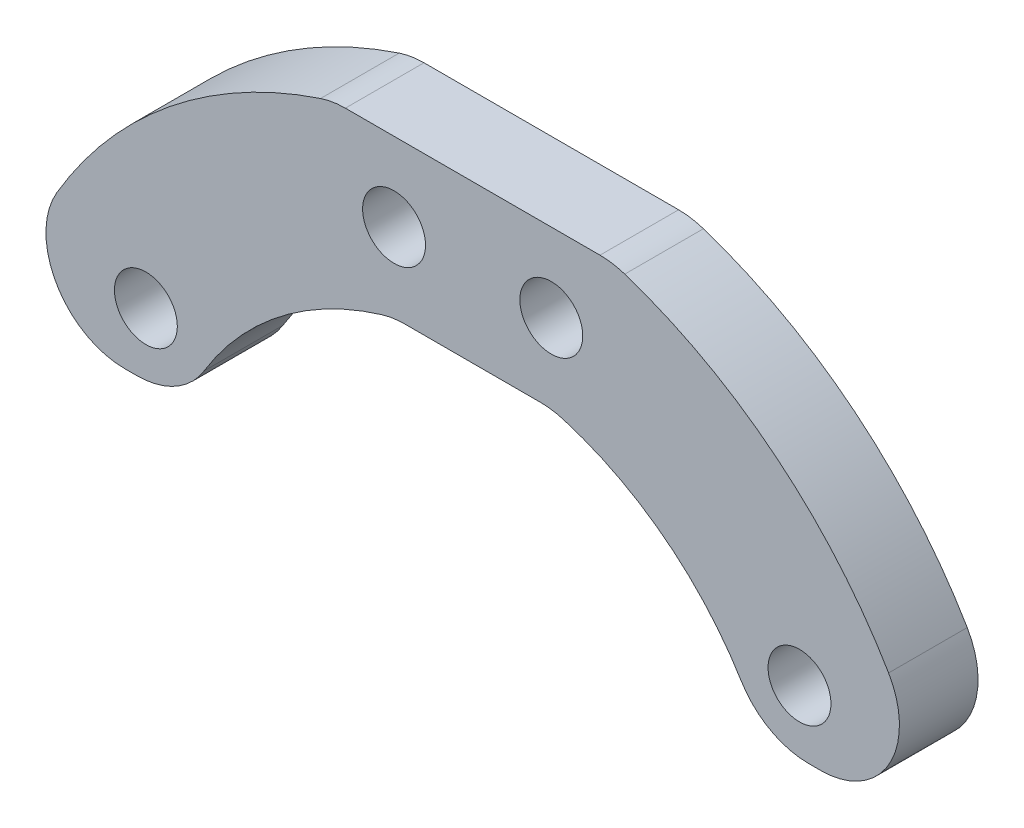
from build123d import *

# Parameters (mm, degrees)
SKETCH1_R           = 2
BOSS_EXTRUDE1_DEPTH = 5
FILLET1_R           = 5


with BuildPart() as part:
    # Sketch1 → Boss-Extrude1 (new body)
    with BuildSketch(Plane.XY):
        with BuildLine():
            Line((-29.613436562, 8), (-18.33030278, 8))
            ThreePointArc((-18.33030278, 8), (-12.975595941, 15.219523973), (-5, 19.364916731))
            Line((-5, 19.364916731), (5, 19.364916731))
            ThreePointArc((5, 19.364916731), (12.975595941, 15.219523973), (18.33030278, 8))
            Line((18.33030278, 8), (29.613436562, 8))
            ThreePointArc((29.613436562, 8), (22.00766613, 21.368627857), (8.868894541, 29.364916731))
            Line((8.868894541, 29.364916731), (-8.868894541, 29.364916731))
            ThreePointArc((-8.868894541, 29.364916731), (-22.00766613, 21.368627857), (-29.613436562, 8))
        make_face()
        with Locations((20.784609691, 12)):
            Circle(SKETCH1_R, mode=Mode.SUBTRACT)
        with Locations((-20.784609691, 12)):
            Circle(SKETCH1_R, mode=Mode.SUBTRACT)
        with Locations((-5, 24.364916731)):
            Circle(SKETCH1_R, mode=Mode.SUBTRACT)
        with Locations(Location((5, 24.364916731, 0), (0, 0, 180))):
            Circle(SKETCH1_R, mode=Mode.SUBTRACT)
    extrude(amount=BOSS_EXTRUDE1_DEPTH)

    # Fillet1
    fillet1_edges = [part.edges().sort_by_distance(p)[0] for p in [
        (-18.33030278, 8, 2.5),
        (-29.613436562, 8, 2.5),
        (-8.868894541, 29.364916731, 2.5),
        (8.868894541, 29.364916731, 2.5),
        (29.613436562, 8, 2.5),
        (18.33030278, 8, 2.5),
        (5, 19.364916731, 2.5),
        (-5, 19.364916731, 2.5),
    ]]
    fillet(fillet1_edges, radius=FILLET1_R)


solid = part.part
